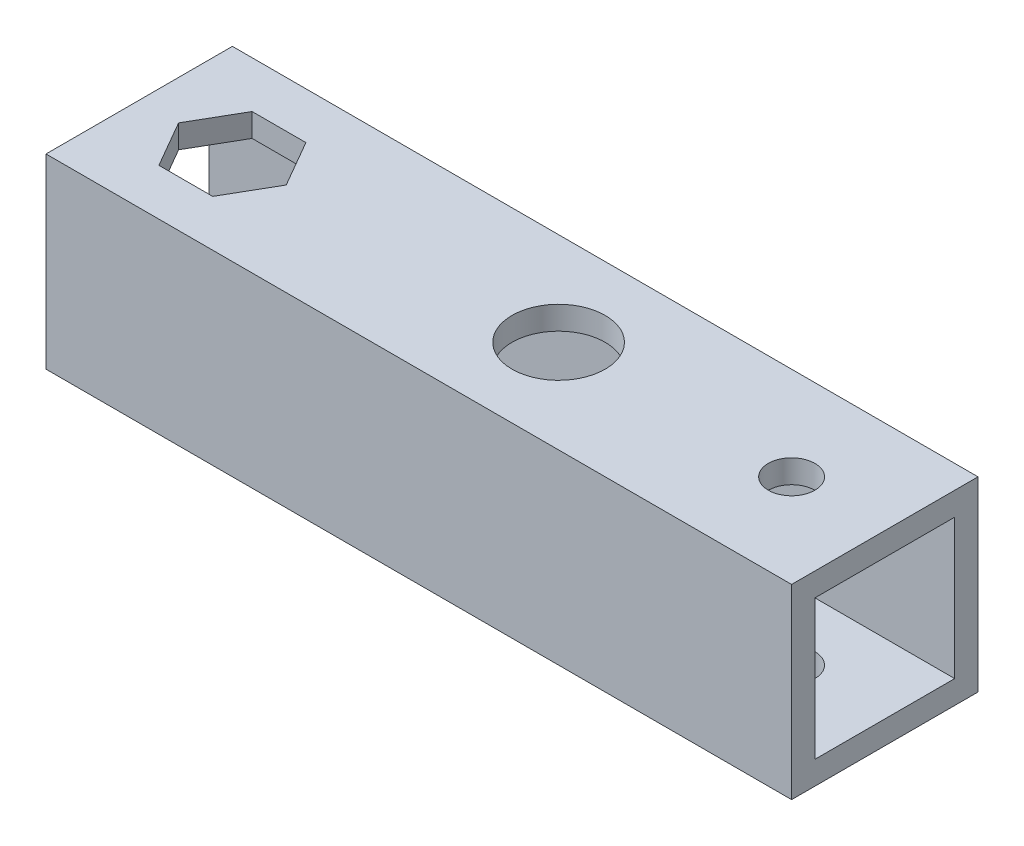
from build123d import *

# Parameters (mm, degrees)
SKETCH1_W           = 101.6
SKETCH1_H           = 25.4
SKETCH1_R           = 6.35
SKETCH1_R_2         = 3.175
BOSS_EXTRUDE1_DEPTH = 25.4
SKETCH2_W           = 19.05
SKETCH2_H           = 19.05
CUT_EXTRUDE1_DEPTH  = 106.494123059


with BuildPart() as part:
    # Sketch1 → Boss-Extrude1 (new body)
    with BuildSketch(Plane(origin=(0, 0, 0), x_dir=(1, 0, 0), z_dir=(0, 1, 0))):
        with Locations((38.1, 0)):
            Rectangle(SKETCH1_W, SKETCH1_H)
        with Locations(Location((44.45, 0, 0), (0, 0, 270))):
            Circle(SKETCH1_R, mode=Mode.SUBTRACT)
        with Locations(Location((76.2, 0, 0), (0, 0, 270))):
            Circle(SKETCH1_R_2, mode=Mode.SUBTRACT)
        Polygon((7.332348419, 0), (3.666174209, 6.35), (-3.666174209, 6.35), (-7.332348419, 0), (-3.666174209, -6.35), (3.666174209, -6.35), align=None, mode=Mode.SUBTRACT)
    extrude(amount=BOSS_EXTRUDE1_DEPTH)

    # Sketch2 → Cut-Extrude1 (cut, through all)
    with BuildSketch(Plane(origin=(88.9, 0, 0), x_dir=(0, 0, -1), z_dir=(1, 0, 0))):
        with Locations((0, 12.7)):
            Rectangle(SKETCH2_W, SKETCH2_H)
    extrude(amount=-CUT_EXTRUDE1_DEPTH, mode=Mode.SUBTRACT)


solid = part.part
